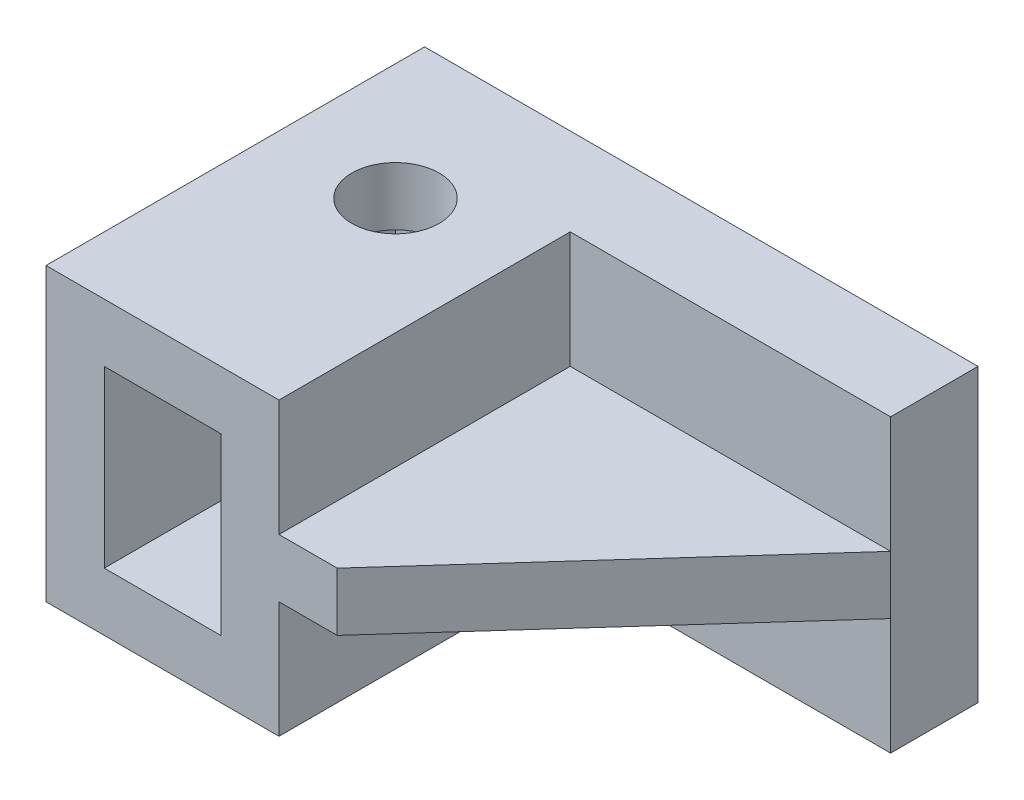
from build123d import *

# Parameters (mm, degrees)
SKETCH1_W               = 2413
SKETCH1_H               = 1270
BOSS_EXTRUDE1_DEPTH     = 381
SKETCH2_W               = 1016
SKETCH2_H               = 1270
BOSS_EXTRUDE2_DEPTH     = 1270
SKETCH3_W               = 508
SKETCH3_H               = 762
CUT_EXTRUDE1_DEPTH      = 1270
SKETCH5_W               = 254
SKETCH5_H               = 254
BOSS_EXTRUDE3_DEPTH     = 1270
BOSS_EXTRUDE4_DEPTH     = 254
CUT_EXTRUDE2_DEPTH      = 3188.674701095
CUT_EXTRUDE2_DEPTH_BACK = 3188.674701095
SKETCH8_R               = 190.5


with BuildPart() as part:
    # Sketch1 → Boss-Extrude1 (new body)
    with BuildSketch(Plane.XY):
        with Locations((1206.5, 635)):
            Rectangle(SKETCH1_W, SKETCH1_H)
    extrude(amount=BOSS_EXTRUDE1_DEPTH)

    # Sketch2 → Boss-Extrude2 (add)
    with BuildSketch(Plane.XY.offset(381)):
        with Locations((508, 635)):
            Rectangle(SKETCH2_W, SKETCH2_H)
    extrude(amount=BOSS_EXTRUDE2_DEPTH)

    # Sketch3 → Cut-Extrude1 (cut)
    with BuildSketch(Plane.XY.offset(1651)):
        with Locations((508, 635)):
            Rectangle(SKETCH3_W, SKETCH3_H)
    extrude(amount=-CUT_EXTRUDE1_DEPTH, mode=Mode.SUBTRACT)

    # Sketch5 → Boss-Extrude3 (add)
    with BuildSketch(Plane.XY.offset(1651)):
        with Locations((1143, 635)):
            Rectangle(SKETCH5_W, SKETCH5_H)
    extrude(amount=-BOSS_EXTRUDE3_DEPTH)

    # Sketch7 → Boss-Extrude4 (add)
    with BuildSketch(Plane.XZ.offset(-508)):
        Polygon((1270, 1651), (2413, 381), (1270, 381), align=None)
    extrude(amount=-BOSS_EXTRUDE4_DEPTH)

    # Sketch8 → Cut-Extrude2 (cut, two sides: drawn at the far end of the back side and taken through both)
    with BuildSketch(Plane.XZ.offset(-CUT_EXTRUDE2_DEPTH_BACK)):
        with Locations(Location((508, 635, 0), (0, 0, 270))):
            Circle(SKETCH8_R)
    extrude(amount=CUT_EXTRUDE2_DEPTH + CUT_EXTRUDE2_DEPTH_BACK, mode=Mode.SUBTRACT)


solid = part.part
